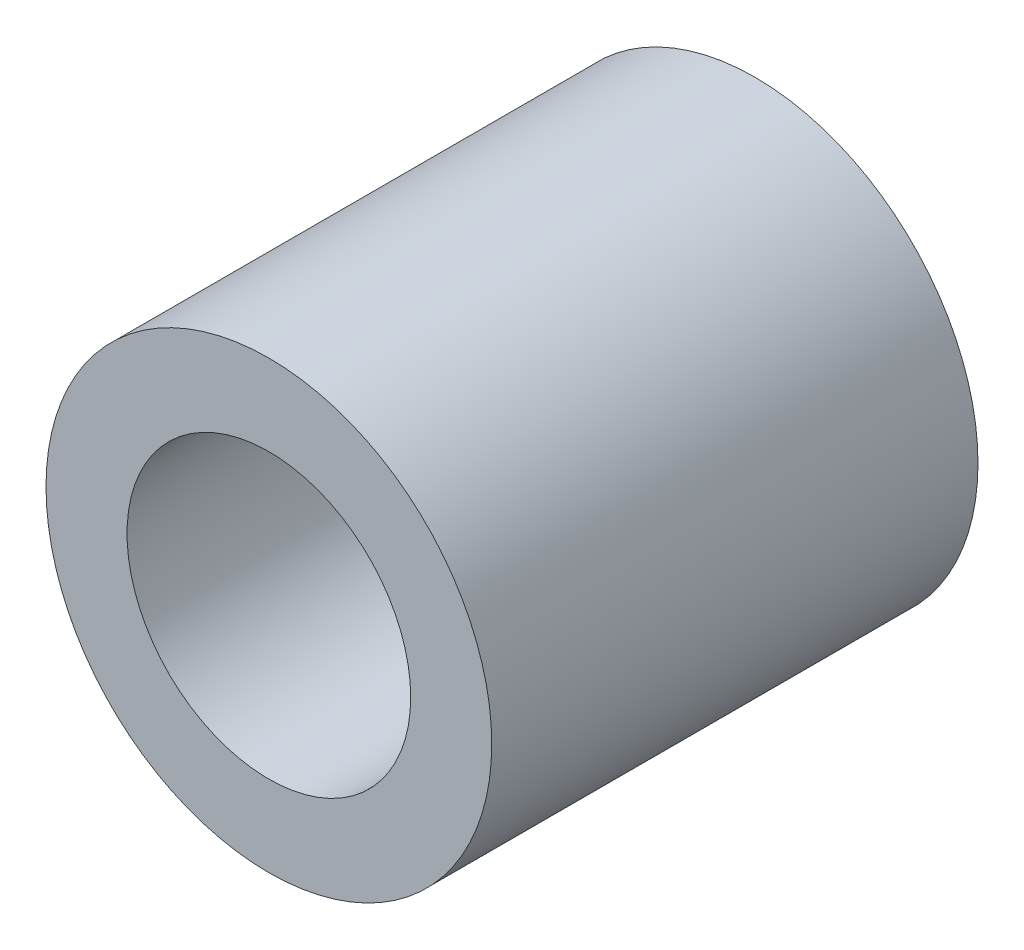
from build123d import *

# Parameters (mm, degrees)
SKETCH1_R           = 5.5
SKETCH1_R_2         = 2.5
BOSS_EXTRUDE1_DEPTH = 20
BOSS_EXTRUDE2_START = -17
SKETCH2_R           = 2.5
BOSS_EXTRUDE2_DEPTH = 2
SKETCH3_R           = 1
CUT_EXTRUDE1_DEPTH  = 2
SKETCH4_R           = 3.5
CUT_EXTRUDE3_DEPTH  = 15
SKETCH5_R           = 6.684025948
CUT_EXTRUDE4_DEPTH  = 8


with BuildPart() as part:
    # Sketch1 → Boss-Extrude1 (new body)
    with BuildSketch(Plane.XY):
        Circle(SKETCH1_R)
        Circle(SKETCH1_R_2, mode=Mode.SUBTRACT)
    extrude(amount=BOSS_EXTRUDE1_DEPTH)

    # Sketch2 → Boss-Extrude2 (add)
    with BuildSketch(Plane.XY.offset(20).offset(BOSS_EXTRUDE2_START)):
        Circle(SKETCH2_R)
    extrude(amount=BOSS_EXTRUDE2_DEPTH)

    # Sketch3 → Cut-Extrude1 (cut)
    with BuildSketch(Plane.XY.offset(5)):
        Circle(SKETCH3_R)
    extrude(amount=-CUT_EXTRUDE1_DEPTH, mode=Mode.SUBTRACT)

    # Sketch4 → Cut-Extrude3 (cut)
    with BuildSketch(Plane.XY.offset(20)):
        Circle(SKETCH4_R)
    extrude(amount=-CUT_EXTRUDE3_DEPTH, mode=Mode.SUBTRACT)

    # Sketch5 → Cut-Extrude4 (cut)
    with BuildSketch(Plane.XY.offset(20)):
        Circle(SKETCH5_R)
    extrude(amount=-CUT_EXTRUDE4_DEPTH, mode=Mode.SUBTRACT)


solid = part.part
